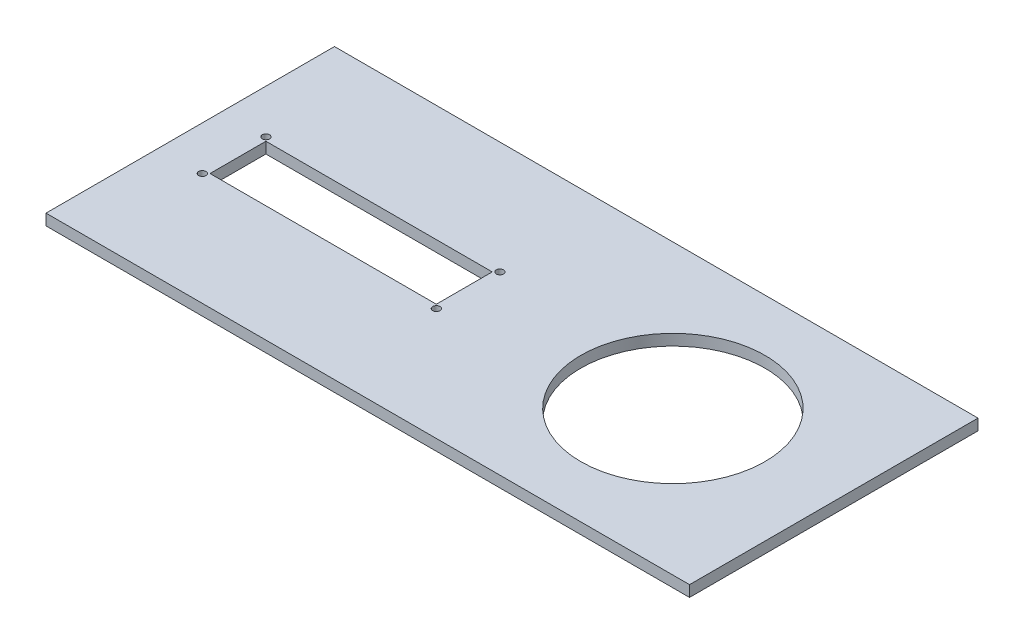
from build123d import *

# Parameters (mm, degrees)
SKETCH1_W           = 368.3
SKETCH1_H           = 165.1
BOSS_EXTRUDE1_DEPTH = 6.35
SKETCH2_R           = 52.705
SKETCH2_R_2         = 2.0828
SKETCH2_W           = 129.54
SKETCH2_H           = 32.004
CUT_EXTRUDE1_DEPTH  = 202.906036314


with BuildPart() as part:
    # Sketch1 → Boss-Extrude1 (new body)
    with BuildSketch(Plane(origin=(0, 0, 0), x_dir=(1, 0, 0), z_dir=(0, 1, 0))):
        Rectangle(SKETCH1_W, SKETCH1_H)
    extrude(amount=BOSS_EXTRUDE1_DEPTH)

    # Sketch2 → Cut-Extrude1 (cut, through all)
    with BuildSketch(Plane(origin=(0, 6.35, 0), x_dir=(1, 0, 0), z_dir=(0, 1, 0))):
        with Locations(Location((92.075, 0, 0), (0, 0, 270))):
            Circle(SKETCH2_R)
        with Locations(Location((-159.0294, 18.1864, 0), (0, 0, 270))):
            Circle(SKETCH2_R_2)
        with Locations(Location((-159.0294, -18.1864, 0), (0, 0, 90))):
            Circle(SKETCH2_R_2)
        with Locations(Location((-25.1206, 18.1864, 0), (0, 0, 90))):
            Circle(SKETCH2_R_2)
        with Locations(Location((-25.1206, -18.1864, 0), (0, 0, 270))):
            Circle(SKETCH2_R_2)
        with Locations((-92.075, 0)):
            Rectangle(SKETCH2_W, SKETCH2_H)
    extrude(amount=-CUT_EXTRUDE1_DEPTH, mode=Mode.SUBTRACT)


solid = part.part
